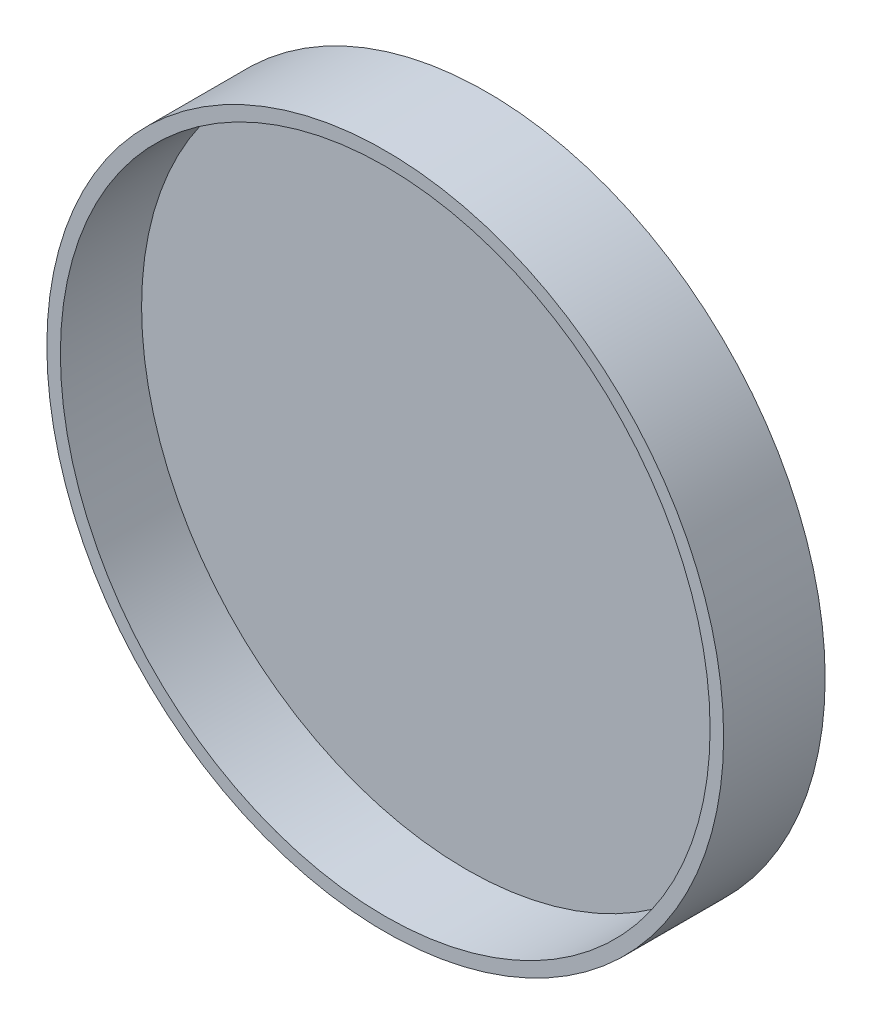
from build123d import *

# Parameters (mm, degrees)
SKETCH1_R           = 50
BOSS_EXTRUDE1_DEPTH = 15
SKETCH2_R           = 48
CUT_EXTRUDE1_DEPTH  = 12


with BuildPart() as part:
    # Sketch1 → Boss-Extrude1 (new body)
    with BuildSketch(Plane.XY):
        Circle(SKETCH1_R)
    extrude(amount=BOSS_EXTRUDE1_DEPTH)

    # Sketch2 → Cut-Extrude1 (cut)
    with BuildSketch(Plane.XY.offset(15)):
        Circle(SKETCH2_R)
    extrude(amount=-CUT_EXTRUDE1_DEPTH, mode=Mode.SUBTRACT)


solid = part.part
